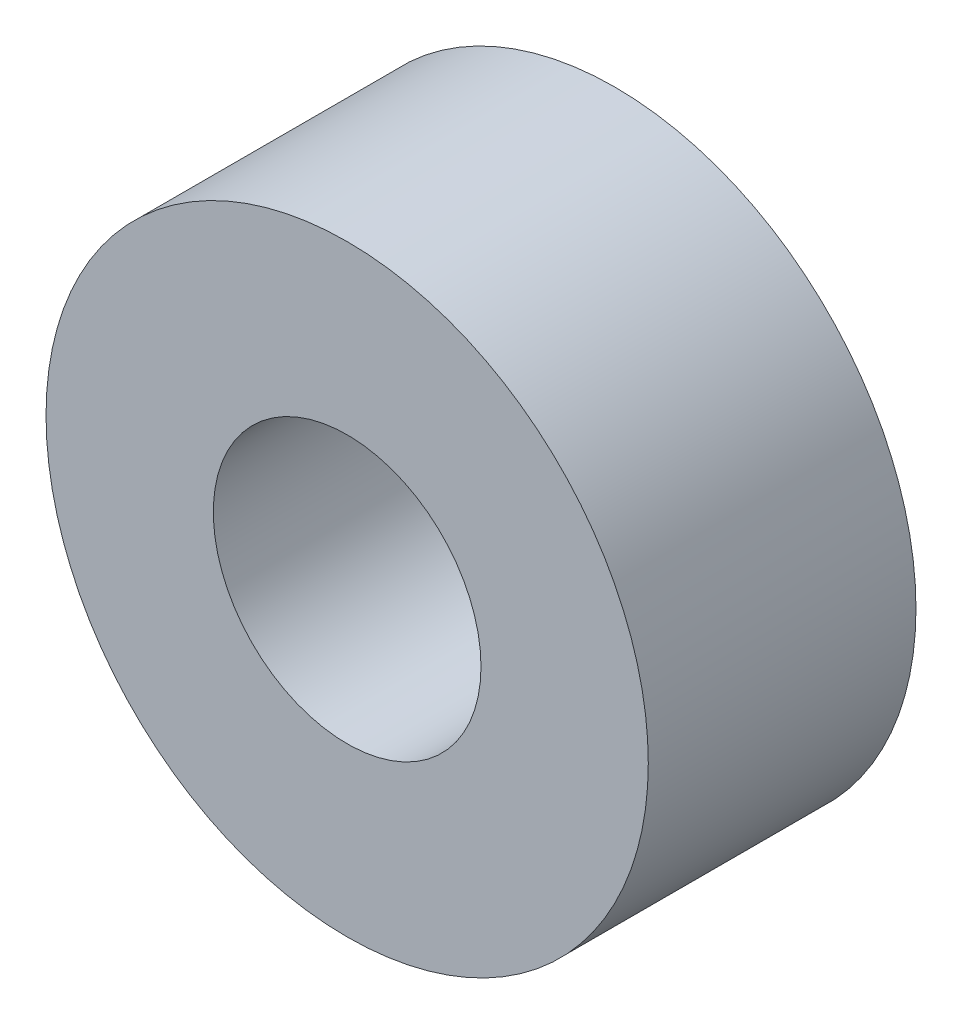
from build123d import *

# Parameters (mm, degrees)
ESBO_O1_R                = 4.5
ESBO_O1_R_2              = 2
RESSALTO_EXTRUS_O1_DEPTH = 4


with BuildPart() as part:
    # Esboço1 → Ressalto-extrusão1 (new body)
    with BuildSketch(Plane.XY):
        Circle(ESBO_O1_R)
        Circle(ESBO_O1_R_2, mode=Mode.SUBTRACT)
    extrude(amount=RESSALTO_EXTRUS_O1_DEPTH)


solid = part.part
